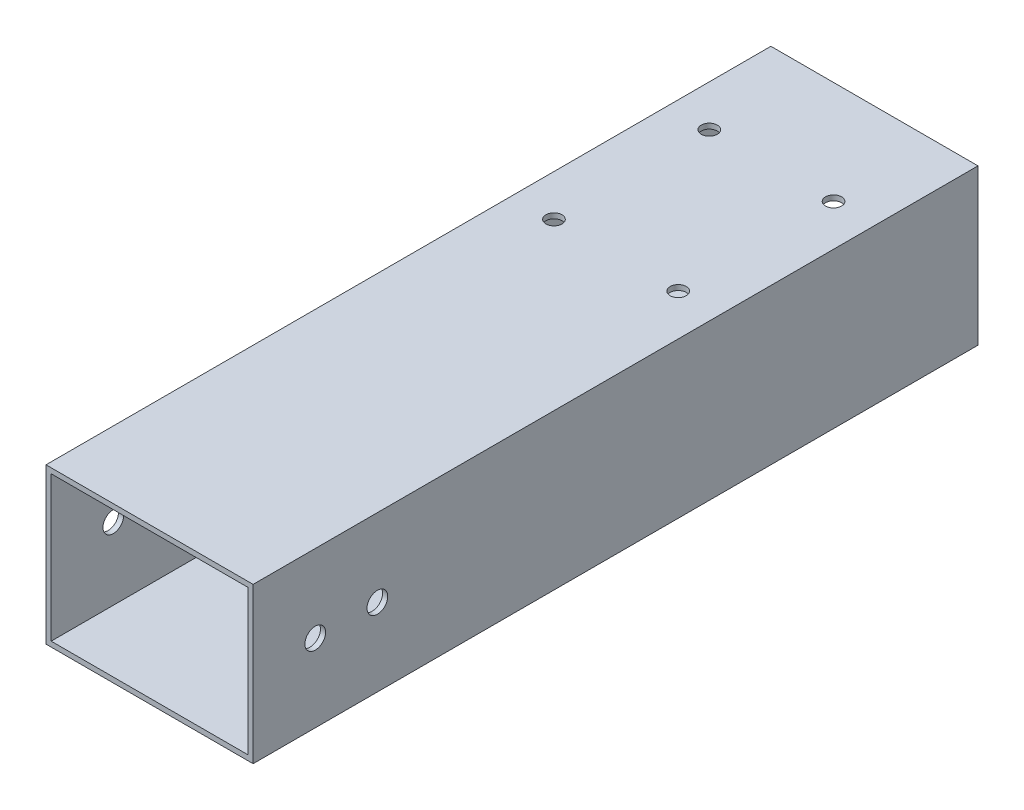
from build123d import *

# Parameters (mm, degrees)
SKETCH_1_W          = 40
SKETCH_1_H          = 30
SKETCH_1_W_2        = 38
SKETCH_1_H_2        = 28
EXTRUDE_1_DEPTH     = 140
SKETCH_2_R          = 2
CUT_EXTRUDE_1_DEPTH = 149.660687473
SKETCH_3_R          = 1.55
CUT_EXTRUDE_2_DEPTH = 149.660687473


with BuildPart() as part:
    # 草图1 → 凸台-拉伸1 (new body)
    with BuildSketch(Plane.XY):
        with Locations((20, 15)):
            Rectangle(SKETCH_1_W, SKETCH_1_H)
        with Locations((20, 15)):
            Rectangle(SKETCH_1_W_2, SKETCH_1_H_2, mode=Mode.SUBTRACT)
    extrude(amount=EXTRUDE_1_DEPTH)

    # 草图2 → 切除-拉伸1 (cut, through all)
    with BuildSketch(Plane(origin=(0, 0, 0), x_dir=(0, 0, -1), z_dir=(1, 0, 0))):
        with Locations(Location((-116, 15, 0), (0, 0, 180))):
            Circle(SKETCH_2_R)
        with Locations(Location((-128, 15, 0), (0, 0, 180))):
            Circle(SKETCH_2_R)
    extrude(amount=CUT_EXTRUDE_1_DEPTH, mode=Mode.SUBTRACT)

    # 草图3 → 切除-拉伸2 (cut, through all)
    with BuildSketch(Plane(origin=(0, 0, 0), x_dir=(1, 0, 0), z_dir=(0, 1, 0))):
        with Locations(Location((8, -19.9, 0), (0, 0, 90))):
            Circle(SKETCH_3_R)
        with Locations(Location((32, -19.9, 0), (0, 0, 90))):
            Circle(SKETCH_3_R)
        with Locations(Location((32, -49.9, 0), (0, 0, 90))):
            Circle(SKETCH_3_R)
        with Locations(Location((8, -49.9, 0), (0, 0, 90))):
            Circle(SKETCH_3_R)
    extrude(amount=CUT_EXTRUDE_2_DEPTH, mode=Mode.SUBTRACT)


solid = part.part
